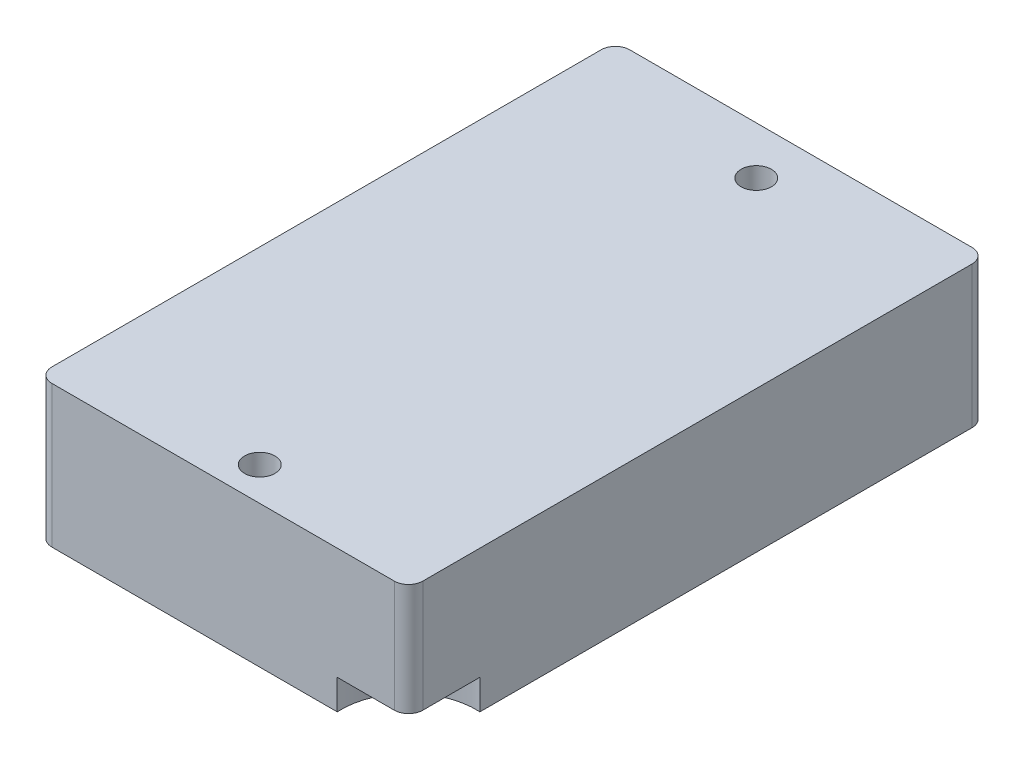
from build123d import *

# Parameters (mm, degrees)
SKETCH1_W          = 66.04
SKETCH1_H          = 102.87
EXTRUDE1_DEPTH     = 25.2476
FILLET1_R          = 2.54
SKETCH2_R          = 0.3175
EXTRUDE2_DEPTH     = 5.334
LPATTERN1_COUNT    = 25
LPATTERN1_PITCH    = 2.54
SKETCH3_R          = 0.3175
EXTRUDE3_DEPTH     = 5.334
LPATTERN2_COUNT    = 16
LPATTERN2_PITCH    = 2.54
CUT_EXTRUDE1_START = -5.334
CUT_EXTRUDE1_DEPTH = 5.334
SKETCH5_R          = 2.7051
CUT_EXTRUDE2_DEPTH = 25.654


with BuildPart() as part:
    # Sketch1 → Extrude1 (new body)
    with BuildSketch(Plane(origin=(0, 0, 0), x_dir=(1, 0, 0), z_dir=(0, 1, 0))):
        with Locations((33.02, 51.435)):
            Rectangle(SKETCH1_W, SKETCH1_H)
    extrude(amount=EXTRUDE1_DEPTH)

    # Fillet1
    fillet1_edges = [part.edges().sort_by_distance(p)[0] for p in [
        (0, 12.6238, -102.87),
        (66.04, 12.6238, -102.87),
        (66.04, 12.6238, 0),
        (0, 12.6238, 0),
    ]]
    fillet(fillet1_edges, radius=FILLET1_R)

    # Sketch2 → Extrude2 (add)
    with BuildSketch(Plane.XZ):
        with Locations(Location((56.1848, -20.955, 0), (0, 0, 270))):
            Circle(SKETCH2_R)
        with Locations(Location((58.7248, -20.955, 0), (0, 0, 270))):
            Circle(SKETCH2_R)
    extrude2 = extrude(amount=EXTRUDE2_DEPTH)

    # LPattern1: Extrude2 ×25
    with Locations(*[(0, 0, -i * LPATTERN1_PITCH) for i in range(1, LPATTERN1_COUNT)]):
        add(extrude2)

    # Sketch3 → Extrude3 (add)
    with BuildSketch(Plane.XZ):
        with Locations(Location((8.4328, -69.215, 0), (0, 0, 270))):
            Circle(SKETCH3_R)
        with Locations(Location((10.9728, -69.215, 0), (0, 0, 270))):
            Circle(SKETCH3_R)
    extrude3 = extrude(amount=EXTRUDE3_DEPTH)

    # LPattern2: Extrude3 ×16
    with Locations(*[(0, 0, i * LPATTERN2_PITCH) for i in range(1, LPATTERN2_COUNT)]):
        add(extrude3)

    # Sketch4 → Cut-Extrude1 (cut)
    with BuildSketch(Plane.XZ.offset(CUT_EXTRUDE1_START)):
        with BuildLine():
            Line((53.34, 0), (63.5, 0))
            ThreePointArc((63.5, 0), (65.296051224, -0.743948776), (66.04, -2.54))
            Line((66.04, -2.54), (66.04, -12.7))
            ThreePointArc((66.04, -12.7), (56.838081011, -9.201918989), (53.34, 0))
        make_face()
        with BuildLine():
            Line((12.7, -102.87), (2.54, -102.87))
            ThreePointArc((2.54, -102.87), (0.743948776, -102.126051224), (0, -100.33))
            Line((0, -100.33), (0, -90.17))
            ThreePointArc((0, -90.17), (9.206362116, -93.663637884), (12.7, -102.87))
        make_face()
    extrude(amount=CUT_EXTRUDE1_DEPTH, mode=Mode.SUBTRACT)

    # Sketch5 → Cut-Extrude2 (cut)
    with BuildSketch(Plane.XZ):
        with Locations(Location((33.5788, -5.969, 0), (0, 0, 270))):
            Circle(SKETCH5_R)
        with Locations(Location((33.5788, -94.361, 0), (0, 0, 270))):
            Circle(SKETCH5_R)
    extrude(amount=-CUT_EXTRUDE2_DEPTH, mode=Mode.SUBTRACT)


solid = part.part
